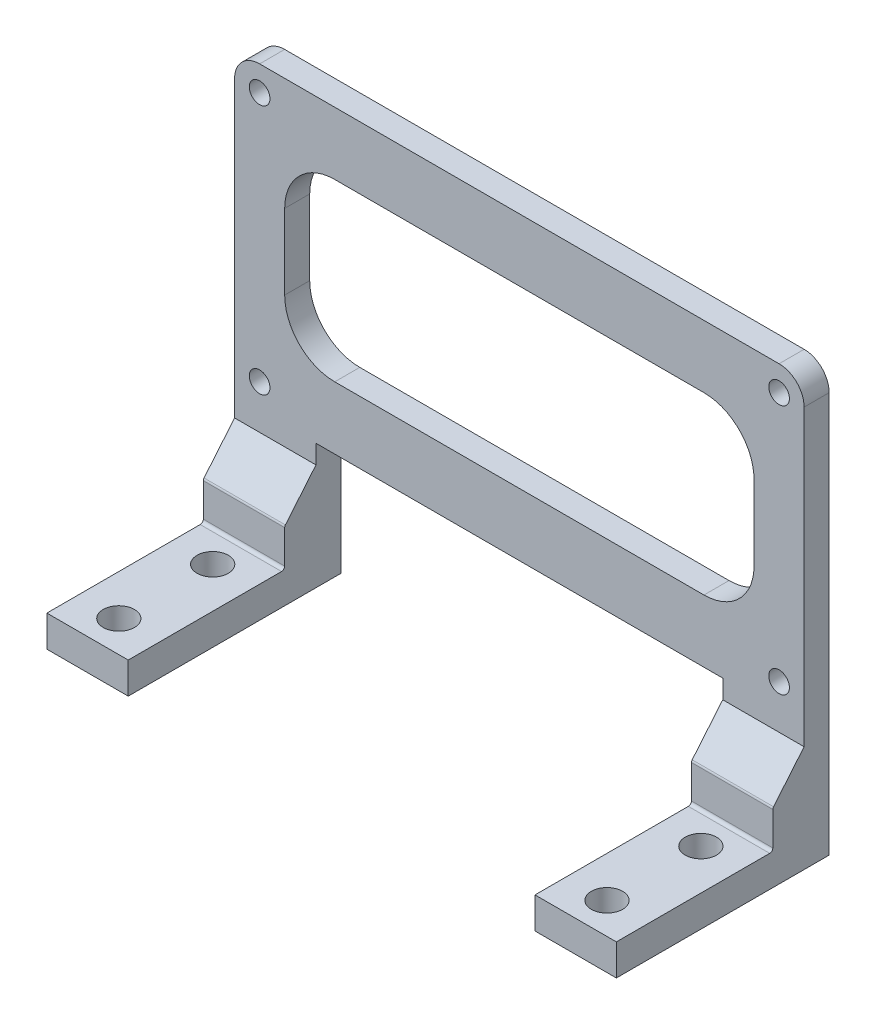
from build123d import *

# Parameters (mm, degrees)
SKETCH_1_W          = 91
SKETCH_1_H          = 48
EXTRUDE_1_DEPTH     = 4
SKETCH_2_W          = 75
SKETCH_2_H          = 28
CUT_EXTRUDE_1_DEPTH = 52.596996037
FILLET_2_R          = 8
SKETCH_3_R          = 1.65
CUT_EXTRUDE_2_DEPTH = 52.596996037
SKETCH_5_W          = 13
SKETCH_5_H          = 20
EXTRUDE_2_DEPTH     = 4
SKETCH_6_W          = 13
SKETCH_6_H          = 5
EXTRUDE_3_DEPTH     = 30
EXTRUDE_4_DEPTH     = 13
SKETCH_8_R          = 2.5
CUT_EXTRUDE_3_DEPTH = 30
CUT_EXTRUDE_4_DEPTH = 107.644268482
FILLET_3_R          = 0.5
FILLET_4_R          = 4


with BuildPart() as part:
    # 草图1 → 凸台-拉伸1 (new body)
    with BuildSketch(Plane.XY):
        Rectangle(SKETCH_1_W, SKETCH_1_H)
    extrude(amount=EXTRUDE_1_DEPTH)

    # 草图2 → 切除-拉伸1 (cut, through all)
    with BuildSketch(Plane.XY.offset(4)):
        Rectangle(SKETCH_2_W, SKETCH_2_H)
    extrude(amount=-CUT_EXTRUDE_1_DEPTH, mode=Mode.SUBTRACT)

    # 圆角2
    fillet_2_edges = [part.edges().sort_by_distance(p)[0] for p in [
        (37.5, 14, 2),
        (37.5, -14, 2),
        (-37.5, -14, 2),
        (-37.5, 14, 2),
    ]]
    fillet(fillet_2_edges, radius=FILLET_2_R)

    # 草图3 → 切除-拉伸2 (cut, through all)
    with BuildSketch(Plane.XY.offset(4)):
        with Locations((-41.5, 20)):
            Circle(SKETCH_3_R)
        with Locations((-41.5, -20)):
            Circle(SKETCH_3_R)
        with Locations((41.5, 20)):
            Circle(SKETCH_3_R)
        with Locations((41.5, -20)):
            Circle(SKETCH_3_R)
    extrude(amount=-CUT_EXTRUDE_2_DEPTH, mode=Mode.SUBTRACT)

    # 草图5 → 凸台-拉伸2 (add)
    with BuildSketch(Plane(origin=(0, 0, 0), x_dir=(-1, 0, 0), z_dir=(0, 0, -1))):
        with Locations((-39, -34)):
            Rectangle(SKETCH_5_W, SKETCH_5_H)
        with Locations((39, -34)):
            Rectangle(SKETCH_5_W, SKETCH_5_H)
    extrude(amount=-EXTRUDE_2_DEPTH)

    # 草图6 → 凸台-拉伸3 (add)
    with BuildSketch(Plane.XY.offset(4)):
        with Locations((-39, -41.5)):
            Rectangle(SKETCH_6_W, SKETCH_6_H)
        with Locations((39, -41.5)):
            Rectangle(SKETCH_6_W, SKETCH_6_H)
    extrude(amount=EXTRUDE_3_DEPTH)

    # 草图7 → 凸台-拉伸4 (add)
    with BuildSketch(Plane(origin=(45.5, 0, 0), x_dir=(0, 0, -1), z_dir=(1, 0, 0))):
        Polygon((-4, -27), (-14, -39), (-4, -39), align=None)
    extrude_4 = extrude(amount=-EXTRUDE_4_DEPTH)

    # 镜向2: 凸台-拉伸4 across plane
    add(extrude_4.mirror(Plane(origin=(0, 0, 0), x_dir=(0, 0, 1), z_dir=(1, 0, 0))))

    # 草图8 → 切除-拉伸3 (cut)
    with BuildSketch(Plane.XZ.offset(44)):
        with Locations((39, 29)):
            Circle(SKETCH_8_R)
        with Locations((-39, 29)):
            Circle(SKETCH_8_R)
        with Locations((39, 14)):
            Circle(SKETCH_8_R)
        with Locations((-39, 14)):
            Circle(SKETCH_8_R)
    extrude(amount=-CUT_EXTRUDE_3_DEPTH, mode=Mode.SUBTRACT)

    # 草图9 → 切除-拉伸4 (cut, through all)
    with BuildSketch(Plane.ZY.offset(45.5)):
        Polygon((9, -33), (9, -39), (14, -39), align=None)
    extrude(amount=-CUT_EXTRUDE_4_DEPTH, mode=Mode.SUBTRACT)

    # 圆角3
    fillet_3_edges = [part.edges().sort_by_distance(p)[0] for p in [
        (39, -39, 9),
        (39, -33, 9),
        (-39, -33, 9),
        (-39, -39, 9),
    ]]
    fillet(fillet_3_edges, radius=FILLET_3_R)

    # 圆角4
    fillet_4_edges = [part.edges().sort_by_distance(p)[0] for p in [
        (-45.5, 24, 2),
        (45.5, 24, 2),
    ]]
    fillet(fillet_4_edges, radius=FILLET_4_R)


solid = part.part
